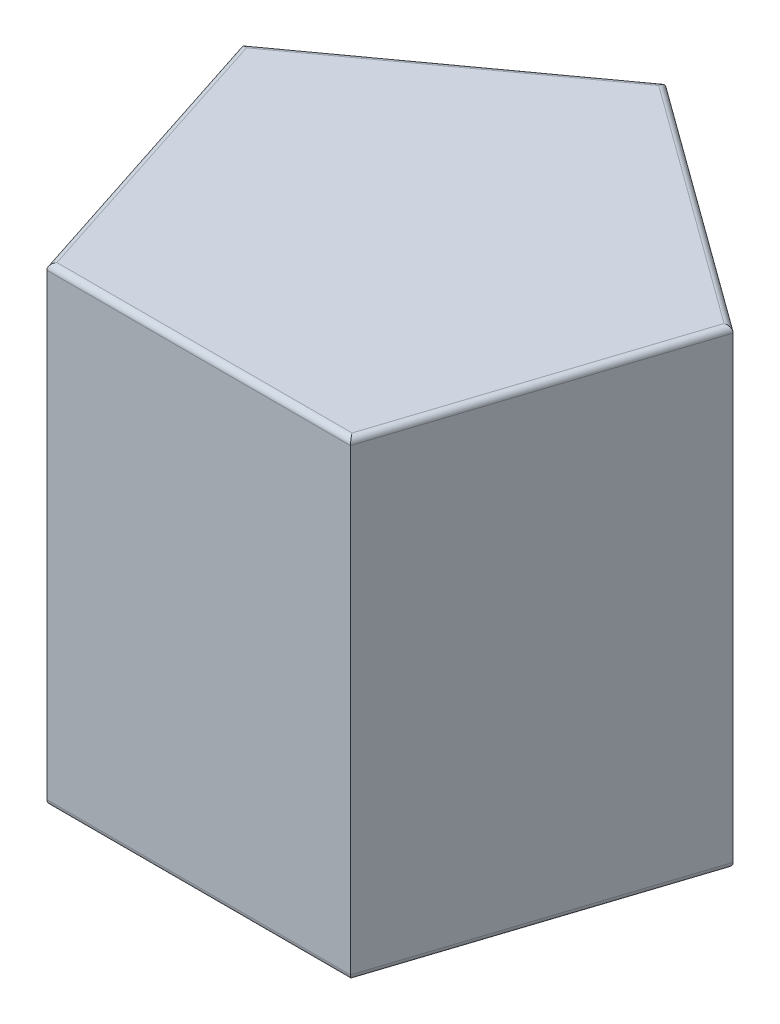
from build123d import *

# Parameters (mm, degrees)
BOSS_EXTRUDE1_DEPTH = 40
FILLET1_R           = 0.5


with BuildPart() as part:
    # Sketch1 → Boss-Extrude1 (new body)
    with BuildSketch(Plane(origin=(0, 0, 0), x_dir=(-1, 0, 0), z_dir=(0, 1, 0))):
        Polygon((12.920084942, 17.782971123), (20.905136432, -6.792490393), (2.28e-07, -21.980960899), (-20.905135976, -6.792490393), (-12.920084486, 17.782971123), align=None)
    extrude(amount=BOSS_EXTRUDE1_DEPTH)

    # Fillet1
    fillet1_edges = [part.edges().sort_by_distance(p)[0] for p in [
        (10.452567874, 40, -14.386725646),
        (-10.45256833, 40, -14.386725646),
        (-16.912610687, 40, 5.495240365),
        (-2.28e-07, 40, 17.782971123),
        (-16.912610687, 0, 5.495240365),
        (-10.45256833, 0, -14.386725646),
        (10.452567874, 0, -14.386725646),
        (16.912610231, 0, 5.495240365),
        (-2.28e-07, 0, 17.782971123),
        (16.912610231, 40, 5.495240365),
    ]]
    fillet(fillet1_edges, radius=FILLET1_R)


solid = part.part
